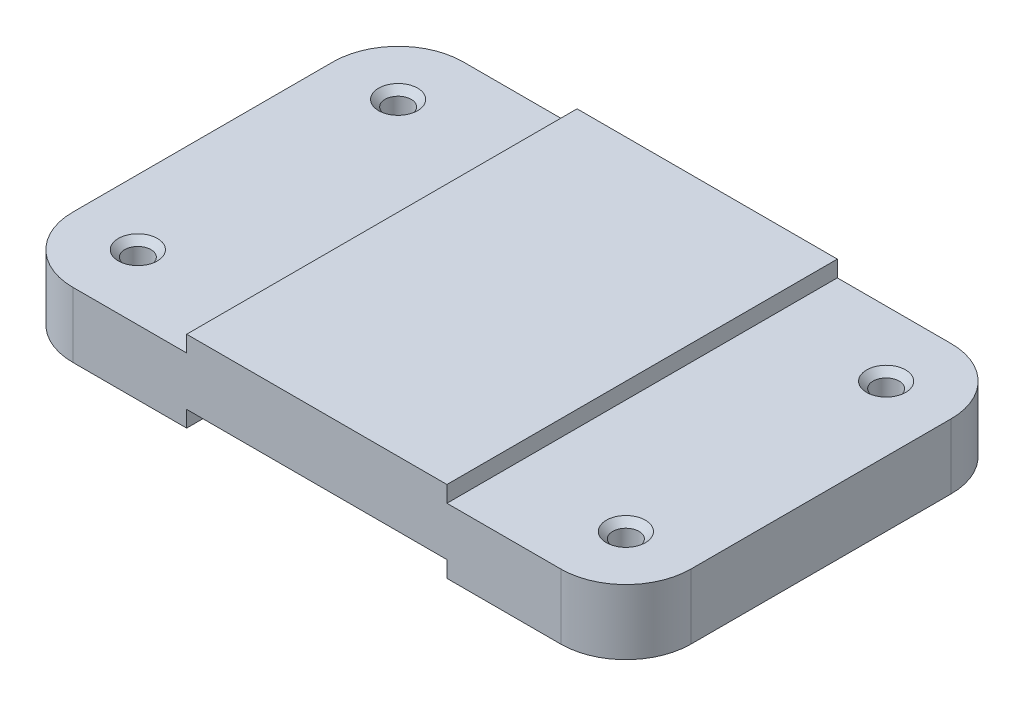
from build123d import *

# Parameters (mm, degrees)
BOSS_EXTRUDE1_DEPTH               = 38.1
FILLET1_R                         = 12.7
F_1_4_20_TAPPED_HOLE1_D           = 5.1054
F_1_4_20_TAPPED_HOLE1_CSINK_D     = 7.62
F_1_4_20_TAPPED_HOLE1_CSINK_ANGLE = 90


with BuildPart() as part:
    # Sketch1 → Boss-Extrude1 (new, symmetric)
    with BuildSketch(Plane.XY):
        Polygon((-25.4, 0), (25.4, 0), (25.4, -3.175), (60.325, -3.175), (60.325, -15.875), (25.4, -15.875), (25.4, -12.7), (-25.4, -12.7), (-25.4, -15.875), (-60.325, -15.875), (-60.325, -3.175), (-25.4, -3.175), align=None)
    extrude(amount=BOSS_EXTRUDE1_DEPTH, both=True)

    # Fillet1
    fillet1_edges = [part.edges().sort_by_distance(p)[0] for p in [
        (-60.325, -9.525, 38.1),
        (60.325, -9.525, -38.1),
        (-60.325, -9.525, -38.1),
        (60.325, -9.525, 38.1),
    ]]
    fillet(fillet1_edges, radius=FILLET1_R)

    # 1/4-20 Tapped Hole1 (through all)
    with Locations(Plane(origin=(0, -3.175, 0), x_dir=(1, 0, 0), z_dir=(0, 1, 0))):
        with Locations((-47.625, 25.4), (-47.625, -25.4), (47.625, -25.4), (47.625, 25.4)):
            CounterSinkHole(F_1_4_20_TAPPED_HOLE1_D / 2, F_1_4_20_TAPPED_HOLE1_CSINK_D / 2, counter_sink_angle=F_1_4_20_TAPPED_HOLE1_CSINK_ANGLE)


solid = part.part
